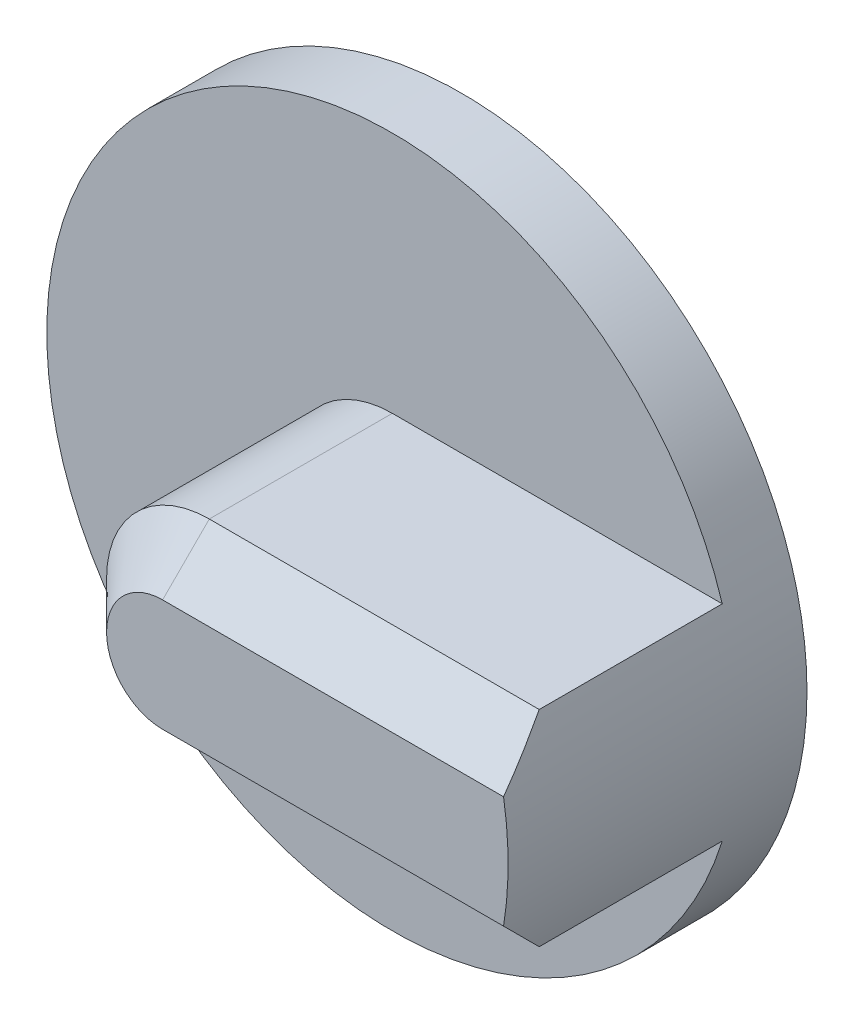
from build123d import *

# Parameters (mm, degrees)
SKETCH1_R           = 37
BOSS_EXTRUDE1_DEPTH = 7.4
BOSS_EXTRUDE2_DEPTH = 24.6
CHAMFER1_SIZE       = 5


with BuildPart() as part:
    # Sketch1 → Boss-Extrude1 (new body)
    with BuildSketch(Plane.XY.offset(60)):
        Circle(SKETCH1_R)
    extrude(amount=BOSS_EXTRUDE1_DEPTH)

    # Sketch2 → Boss-Extrude2 (add)
    with BuildSketch(Plane.XY.offset(67.4)):
        with BuildLine():
            Line((0, 11), (35.327043, 11))
            ThreePointArc((35.327043, 11), (37, 0), (35.327043, -11))
            Line((35.327043, -11), (0, -11))
            ThreePointArc((0, -11), (-11, 0), (0, 11))
        make_face()
    extrude(amount=BOSS_EXTRUDE2_DEPTH)

    # Chamfer1
    chamfer1_edges = [part.edges().sort_by_distance(p)[0] for p in [
        (17.663522, 11, 92),
        (17.663522, -11, 92),
        (-11, 0, 92),
    ]]
    chamfer(chamfer1_edges, length=CHAMFER1_SIZE)


solid = part.part
